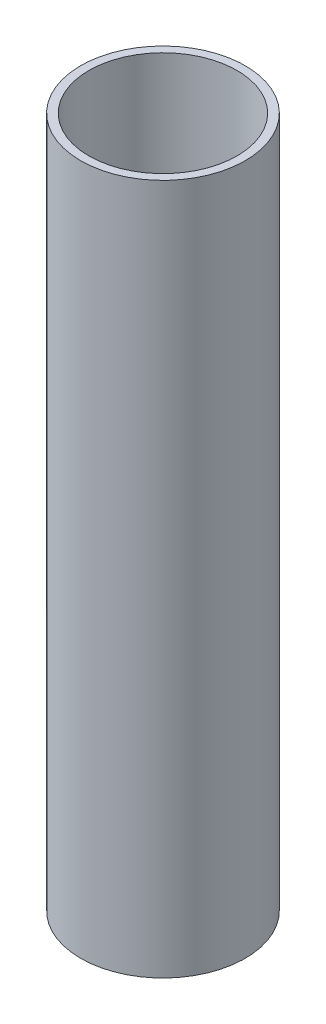
from build123d import *

# Parameters (mm, degrees)
SKETCH2_R           = 12.7
BOSS_EXTRUDE1_DEPTH = 106.6
SKETCH3_R           = 11.43
CUT_EXTRUDE1_DEPTH  = 101.6


with BuildPart() as part:
    # Sketch2 → Boss-Extrude1 (new body)
    with BuildSketch(Plane(origin=(0, 0, 0), x_dir=(1, 0, 0), z_dir=(0, 1, 0))):
        with Locations(Location((0, 0, 0), (0, 0, 270))):
            Circle(SKETCH2_R)
    extrude(amount=-BOSS_EXTRUDE1_DEPTH)

    # Sketch3 → Cut-Extrude1 (cut)
    with BuildSketch(Plane(origin=(0, 0, 0), x_dir=(1, 0, 0), z_dir=(0, 1, 0))):
        with Locations(Location((0, 0, 0), (0, 0, 270))):
            Circle(SKETCH3_R)
    extrude(amount=-CUT_EXTRUDE1_DEPTH, mode=Mode.SUBTRACT)


solid = part.part
